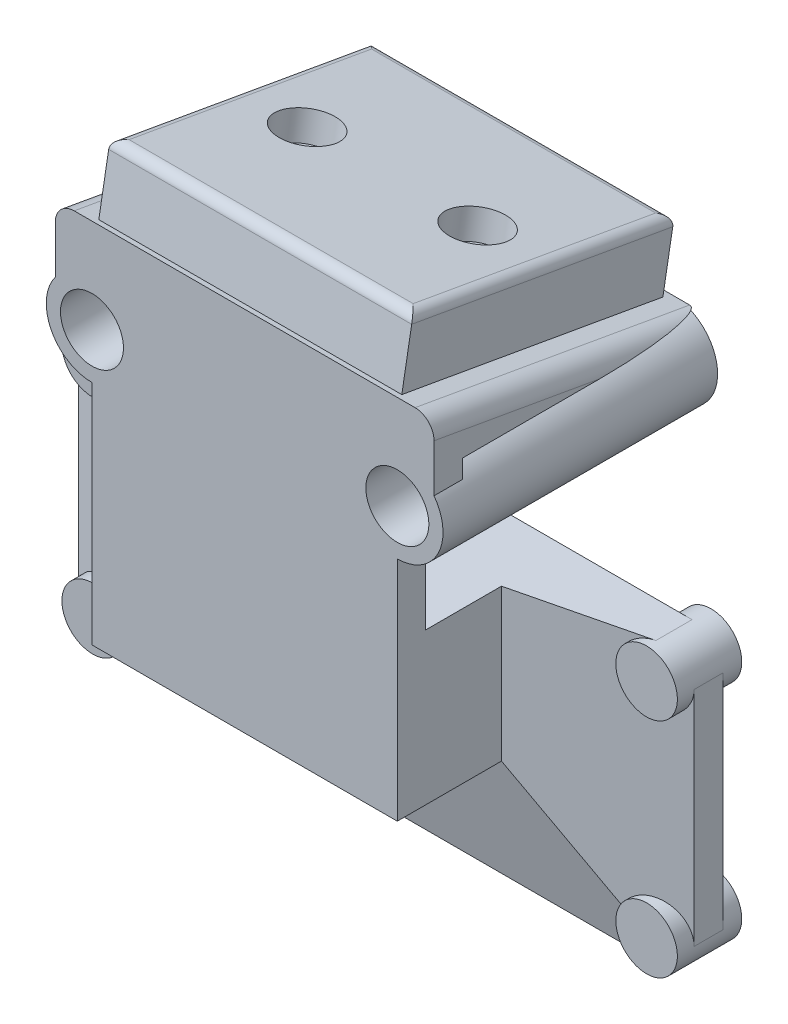
from build123d import *

# Parameters (mm, degrees)
SKETCH_1_R               = 4.824999999999997
SKETCH_1_R_2             = 3.3250000000000033
EXTRUDE_1_DEPTH          = 29
SKETCH_1_R_3             = 4.825
SKETCH_1_R_4             = 3.3249999999999997
EXTRUDE_1_2_DEPTH        = 29
EXTRUDE_2_DEPTH          = 20
EXTRUDE_2_DEPTH_BACK     = 20
FILLET_2_R               = 2
EXTRUDE_11_DEPTH         = 29
EXTRUDE_13_DEPTH         = 7
FILLET_3_R               = 1
SKETCH_11_R              = 3.0000000000000013
SKETCH_11_R_2            = 2.999999999999999
CUT_EXTRUDE_1_DEPTH      = 3
EXTRUDE_START            = -3
EXTRUDE_14_DEPTH         = 3
SKETCH_13_W              = 32.25
SKETCH_13_H              = 3
EXTRUDE_15_DEPTH         = 24
SKETCH_14_W              = 32.25
SKETCH_14_H              = 16
EXTRUDE_16_DEPTH         = 12
EXTRUDE_17_DEPTH         = 3
SKETCH_16_R              = 3.250000000000001
SKETCH_16_R_2            = 3.2500000000000013
SKETCH_16_R_3            = 3.2499999999999982
EXTRUDE_18_DEPTH         = 2
CUT_EXTRUDE_START        = -6
SKETCH_17_W              = 68.56383691944288
SKETCH_17_H              = 32.56782253673537
CUT_EXTRUDE_2_DEPTH      = 6
SKETCH_18_W              = 4.000000000000002
SKETCH_18_H              = 16
EXTRUDE_19_DEPTH         = 16.5
SKETCH_19_W              = 4.000000000000002
SKETCH_19_H              = 16.000000000000007
EXTRUDE_20_DEPTH         = 16.5
CUT_EXTRUDE_4_DEPTH      = 17
EXTRUDE_21_DEPTH         = 15
CUT_EXTRUDE_5_DEPTH      = 25
CUT_EXTRUDE_5_DEPTH_BACK = 55.00000000000001
CUT_EXTRUDE_START_2      = -5
SKETCH_23_W              = 70.20398187811678
SKETCH_23_H              = 36.48154516810434
CUT_EXTRUDE_6_DEPTH      = 5
EXTRUDE_START_2          = -4.8
SKETCH_16_2_R            = 3.250000000000001
SKETCH_16_2_R_2          = 3.2500000000000013
SKETCH_16_2_R_3          = 3.2499999999999982
EXTRUDE_22_DEPTH         = 4.8


with BuildPart() as part:
    # Эскиз1 → Бобышка-Вытянуть1 (new body)
    with BuildSketch(Plane.XY):
        with Locations((16.125, 0)):
            Circle(SKETCH_1_R)
        with Locations((16.125, 0)):
            Circle(SKETCH_1_R_2, mode=Mode.SUBTRACT)
    extrude(amount=EXTRUDE_1_DEPTH)



with BuildPart() as body_2:
    # Эскиз1 → Extrude 1 2 (new body)
    with BuildSketch(Plane.XY):
        with Locations((-16.125, 0)):
            Circle(SKETCH_1_R_3)
        with Locations((-16.125, 0)):
            Circle(SKETCH_1_R_4, mode=Mode.SUBTRACT)
    extrude(amount=EXTRUDE_1_2_DEPTH)


with BuildPart() as body_3:
    # Эскиз4 → Бобышка-Вытянуть2 (new, two sides: drawn at the far end of the back side and taken through both)
    with BuildSketch(Plane(origin=(0, 0, 0), x_dir=(0, 0, -1), z_dir=(1, 0, 0)).offset(-EXTRUDE_2_DEPTH_BACK)):
        Polygon((-29, 4.824999999999997), (-29, 9.938482440545272), (-1.388e-14, 4.824999999999997), align=None)
    extrude(amount=EXTRUDE_2_DEPTH + EXTRUDE_2_DEPTH_BACK)

    # Скругление2
    fillet_2_edges = [body_3.edges().sort_by_distance(p)[0] for p in [
        (20, 7.381741220272634, 14.500000000000007),
        (-20, 7.381741220272634, 14.500000000000007),
    ]]
    fillet(fillet_2_edges, radius=FILLET_2_R)


with BuildPart() as part_1:
    add(part.part)

    add(body_2.part)  # Бобышка-Вытянуть11 merges body 2

    add(body_3.part)  # Бобышка-Вытянуть11 merges body 3
    # Эскиз10 → Бобышка-Вытянуть11 (add)
    with BuildSketch(Plane(origin=(0, 0, 0), x_dir=(-1, 0, 0), z_dir=(0, 0, -1))):
        Polygon((-16.125, 4.8249999999999975), (16.125, 4.824999999999997), (16.125, 3.3249999999999975), (-16.125, 3.3249999999999975), align=None)
    extrude(amount=-EXTRUDE_11_DEPTH)

    # Эскиз6 → Бобышка-Вытянуть13 (add)
    with BuildSketch(Plane(origin=(0, 4.6795084476460085, -0.8251235957731434), x_dir=(1, 0, 0), z_dir=(0, 0.9848077530122092, -0.17364817766692356))):
        Polygon((-16, -1.6794043064520388), (-16, -29.67940430645204), (16, -29.679404306452035), (16, -1.6794043064520352), align=None)
    extrude(amount=EXTRUDE_13_DEPTH)

    # Скругление3
    fillet_3_edges = [part_1.edges().sort_by_distance(p)[0] for p in [
        (0, 16.726937190786714, 27.18784662633631),
        (16, 14.295862703449783, 13.400538084165378),
        (0, 11.864788216112855, -0.38677045800554954),
        (-16, 14.295862703449785, 13.400538084165381),
    ]]
    fillet(fillet_3_edges, radius=FILLET_3_R)

    # Эскиз11 → Вырез-Вытянуть1 (cut)
    with BuildSketch(Plane(origin=(0, 11.57316271873147, -2.0406608394416086), x_dir=(1, 0, 0), z_dir=(0, 0.9848077530122092, -0.1736481776669236))):
        with Locations((-9.000000000000005, -15.679404306452042)):
            Circle(SKETCH_11_R)
        with Locations((8.999999999999998, -15.679404306452039)):
            Circle(SKETCH_11_R_2)
    extrude(amount=-CUT_EXTRUDE_1_DEPTH, mode=Mode.SUBTRACT)

    # Эскиз12 → Бобышка-Вытянуть14 (add)
    with BuildSketch(Plane.XY.offset(29).offset(EXTRUDE_START)):
        with BuildLine():
            Line((-16.125000000000018, 4.824999999999999), (-20, 4.824999999999997))
            Line((-20, 4.824999999999997), (-20, 2.874891302293008))
            ThreePointArc((-20, 2.874891302293009), (-18.29401757328477, 4.309986979885419), (-16.125000000000018, 4.824999999999999))
        make_face()
        with BuildLine():
            ThreePointArc((16.125000000000004, 4.824999999999996), (18.294017573284762, 4.30998697988542), (20, 2.8748913022930056))
            Line((20, 2.874891302293005), (20, 4.824999999999997))
            Line((20, 4.824999999999997), (16.125000000000004, 4.824999999999997))
        make_face()
        with BuildLine():
            ThreePointArc((-12.62857325259058, 3.3249999999999975), (-11.690828713276888, -1.9023012379746749), (-16.125000000000014, -4.824999999999999))
            Line((-16.125, -4.824999999999998), (16.125, -4.824999999999997))
            ThreePointArc((16.125000000000004, -4.824999999999996), (11.690828713276861, -1.9023012379746778), (12.628573252590584, 3.3249999999999975))
            Line((12.628573252590584, 3.3249999999999975), (-12.62857325259058, 3.3249999999999975))
        make_face()
    extrude(amount=EXTRUDE_14_DEPTH)

    # Эскиз13 → Бобышка-Вытянуть15 (add)
    with BuildSketch(Plane.XZ.offset(4.8249999999999975)):
        with Locations((0, 27.500000000000004)):
            Rectangle(SKETCH_13_W, SKETCH_13_H)
    extrude(amount=EXTRUDE_15_DEPTH)



with BuildPart() as body_2_2:
    # Эскиз14 → Бобышка-Вытянуть16 (new body)
    with BuildSketch(Plane(origin=(0, 0, 26.000000000000004), x_dir=(-1, 0, 0), z_dir=(0, 0, -1))):
        with Locations((0, -20.824999999999996)):
            Rectangle(SKETCH_14_W, SKETCH_14_H)
    extrude(amount=EXTRUDE_16_DEPTH)


with BuildPart() as part_2:
    add(part_1.part)

    add(body_2_2.part)  # Бобышка-Вытянуть17 merges body 2 2
    # Эскиз15 → Бобышка-Вытянуть17 (add)
    with BuildSketch(Plane(origin=(0, 0, 14.000000000000002), x_dir=(-1, 0, 0), z_dir=(0, 0, -1))):
        Polygon((-32.5, -42.82499999999999), (32.5, -42.82499999999999), (32.5, -12.824999999999992), (-32.5, -12.824999999999982), align=None)
    extrude(amount=EXTRUDE_17_DEPTH)

    # Эскиз16 → Бобышка-Вытянуть18 (add)
    with BuildSketch(Plane(origin=(0, 0, 11.000000000000004), x_dir=(-1, 0, 0), z_dir=(0, 0, -1))):
        with Locations((29.25, -16.074999999999992)):
            Circle(SKETCH_16_R)
        with Locations((-29.250000000000004, -16.0750000000004)):
            Circle(SKETCH_16_R_2)
        with Locations((29.250000000000245, -39.57499999999999)):
            Circle(SKETCH_16_R_3)
        with Locations((-29.24999999999976, -39.5750000000004)):
            Circle(SKETCH_16_R_3)
    extrude(amount=EXTRUDE_18_DEPTH)

    # Эскиз17 → Вырез-Вытянуть2 (cut)
    with BuildSketch(Plane(origin=(0, 0, 11.000000000000004), x_dir=(-1, 0, 0), z_dir=(0, 0, -1)).offset(CUT_EXTRUDE_START)):
        with Locations((-0.2272214266866719, -27.98398422513318)):
            Rectangle(SKETCH_17_W, SKETCH_17_H)
        with BuildLine():
            Line((-32.50000000000001, -16.0750000000004), (-32.49999999999967, -39.57500000000042))
            ThreePointArc((-32.49999999999967, -39.57500000000042), (-31.548097038855932, -41.87309703885639), (-29.24999999999976, -42.82500000000041))
            Line((-29.24999999999976, -42.82500000000041), (29.250000000000245, -42.82499999999999))
            ThreePointArc((29.250000000000245, -42.82499999999999), (31.548097038856366, -41.87309703885618), (32.5, -39.57499999999999))
            Line((32.5, -39.57499999999999), (32.5, -16.074999999999992))
            ThreePointArc((32.5, -16.074999999999992), (31.54809703885628, -13.776902961143712), (29.25, -12.824999999999989))
            Line((29.25, -12.824999999999989), (-29.250000000000004, -12.825000000000399))
            ThreePointArc((-29.250000000000004, -12.825000000000399), (-31.548097038856284, -13.776902961144119), (-32.50000000000001, -16.0750000000004))
        make_face(mode=Mode.SUBTRACT)
    extrude(amount=CUT_EXTRUDE_2_DEPTH, mode=Mode.SUBTRACT)

    # Эскиз18 → Бобышка-Вытянуть19 (add)
    with BuildSketch(Plane(origin=(16.125, 8.7e-16, 0), x_dir=(0, 0, -1), z_dir=(1, 5e-17, 0))):
        with Locations((-16.000000000000004, -20.824999999999996)):
            Rectangle(SKETCH_18_W, SKETCH_18_H)
    extrude(amount=EXTRUDE_19_DEPTH)

    # Эскиз19 → Бобышка-Вытянуть20 (add)
    with BuildSketch(Plane.ZY.offset(16.125)):
        with Locations((16.000000000000004, -20.824999999999992)):
            Rectangle(SKETCH_19_W, SKETCH_19_H)
    extrude(amount=EXTRUDE_20_DEPTH)

    # Эскиз20 → Вырез-Вытянуть4 (cut)
    with BuildSketch(Plane.XZ.offset(28.824999999999996)):
        Polygon((-16.125, 18.000000000000004), (-32.625, 18.000000000000004), (-32.625, 14.000000000000002), align=None)
        Polygon((16.125, 18.000000000000004), (32.625, 18.000000000000004), (32.625, 14.000000000000002), align=None)
    extrude(amount=-CUT_EXTRUDE_4_DEPTH, mode=Mode.SUBTRACT)

    # Эскиз21 → Бобышка-Вытянуть21 (add)
    with BuildSketch(Plane.XZ.offset(28.824999999999996)):
        Polygon((-32.625, 14.000000000000002), (-16.125, 18.000000000000004), (16.125, 18.000000000000004), (32.625, 14.000000000000002), align=None)
    extrude(amount=EXTRUDE_21_DEPTH)

    # Эскиз22 → Вырез-Вытянуть5 (cut, two sides: drawn at the far end of the back side and taken through both)
    with BuildSketch(Plane.ZY.offset(16.125).offset(-CUT_EXTRUDE_5_DEPTH_BACK)):
        Polygon((18.000000000000004, -28.824999999999996), (18.000000000000004, -43.824999999999996), (14.000000000000002, -43.825), align=None)
    extrude(amount=CUT_EXTRUDE_5_DEPTH + CUT_EXTRUDE_5_DEPTH_BACK, mode=Mode.SUBTRACT)

    # Эскиз23 → Вырез-Вытянуть6 (cut)
    with BuildSketch(Plane(origin=(0, 0, 11.000000000000004), x_dir=(-1, 0, 0), z_dir=(0, 0, -1)).offset(CUT_EXTRUDE_START_2)):
        with Locations((-0.29473783212394267, -28.29954927053208)):
            Rectangle(SKETCH_23_W, SKETCH_23_H)
        with BuildLine():
            Line((-29.250000000000004, -12.825000000000399), (29.25, -12.824999999999989))
            ThreePointArc((29.25, -12.824999999999989), (31.548097038856287, -13.776902961143705), (32.5, -16.074999999999992))
            Line((32.5, -16.074999999999992), (32.50000000000024, -39.57499999999999))
            ThreePointArc((32.50000000000024, -39.57499999999999), (31.548097038856532, -41.87309703885627), (29.25000000000025, -42.82499999999999))
            Line((29.25000000000025, -42.82499999999999), (-29.24999999999976, -42.82500000000041))
            ThreePointArc((-29.24999999999976, -42.82500000000041), (-31.54809703885605, -41.87309703885669), (-32.49999999999976, -39.5750000000004))
            Line((-32.49999999999976, -39.5750000000004), (-32.50000000000001, -16.0750000000004))
            ThreePointArc((-32.50000000000001, -16.0750000000004), (-31.548097038856298, -13.776902961144108), (-29.250000000000004, -12.825000000000399))
        make_face(mode=Mode.SUBTRACT)
    extrude(amount=CUT_EXTRUDE_6_DEPTH, mode=Mode.SUBTRACT)

    # Эскиз16<2> → Бобышка-Вытянуть22 (add)
    with BuildSketch(Plane(origin=(0, 0, 11.000000000000004), x_dir=(-1, 0, 0), z_dir=(0, 0, -1)).offset(EXTRUDE_START_2)):
        with Locations((29.25, -16.074999999999992)):
            Circle(SKETCH_16_2_R)
        with Locations((-29.250000000000004, -16.0750000000004)):
            Circle(SKETCH_16_2_R_2)
        with Locations((29.250000000000245, -39.57499999999999)):
            Circle(SKETCH_16_2_R_3)
        with Locations((-29.24999999999976, -39.5750000000004)):
            Circle(SKETCH_16_2_R_3)
    extrude(amount=EXTRUDE_22_DEPTH)


solid = part_2.part
